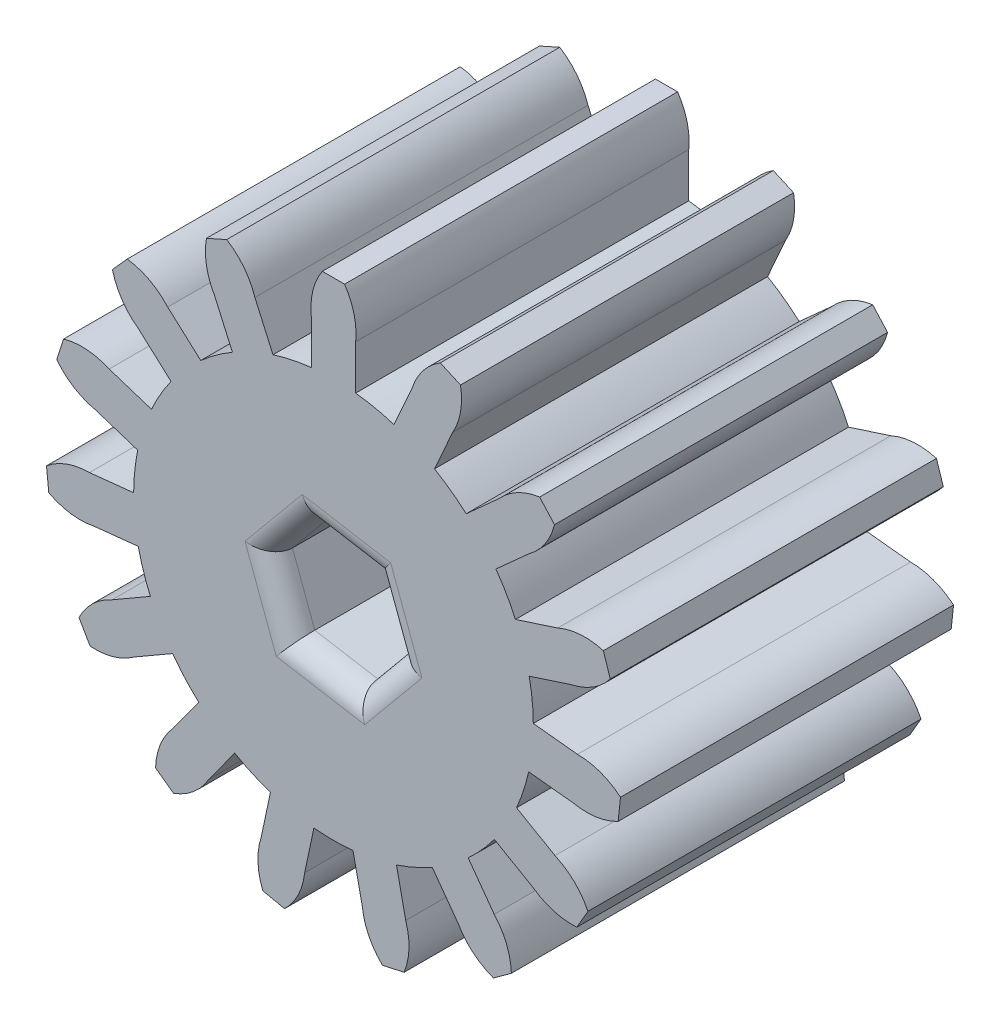
from build123d import *

# Parameters (mm, degrees)
SKETCH1_R                    = 9
SKETCH1_R_2                  = 1
BOSS_EXTRUDE1_DEPTH          = 36
SKETCH5_W                    = 5
SKETCH5_H                    = 4.08502449
SKETCH5_W_2                  = 8
BOSS_EXTRUDE2_DEPTH          = 22
SKETCH7_W                    = 5
SKETCH7_H                    = 4.653899232
CUT_REVOLVE2_ANGLE           = 90
CUT_REVOLVE2_OTHER_WAY_ANGLE = 90
CIRPATTERN1_COUNT            = 15
SKETCH13_W                   = 5
SKETCH13_H                   = 16.616445935
SKETCH17_R                   = 2
CUT_EXTRUDE1_DEPTH           = 10
CUT_EXTRUDE2_DEPTH           = 23
CUT_EXTRUDE2_DEPTH_BACK      = 8
SKETCH20_R                   = 20.157813079
CUT_EXTRUDE3_DEPTH           = 36
FILLET1_R                    = 1


with BuildPart() as part:
    # Sketch1 → Boss-Extrude1 (new body)
    with BuildSketch(Plane.XY):
        Circle(SKETCH1_R)
        Circle(SKETCH1_R_2, mode=Mode.SUBTRACT)
    extrude(amount=BOSS_EXTRUDE1_DEPTH)

    # Sketch5 → Cut-Revolve1 (revolve, cut)
    with BuildSketch(Plane(origin=(0, 0, 0), x_dir=(0, 0, -1), z_dir=(1, 0, 0)), mode=Mode.PRIVATE) as cut_revolve1_sk:
        with Locations((-2.5, 6.957487755)):
            Rectangle(SKETCH5_W, SKETCH5_H)
        with Locations((-32, 6.957487755)):
            Rectangle(SKETCH5_W_2, SKETCH5_H)
    revolve(cut_revolve1_sk.sketch.rotate(Axis((0, 0, 0), (0, 0, 1)), 90), axis=Axis((0, 0, 0), (0, 0, 1)), mode=Mode.SUBTRACT)

    # Sketch6 → Boss-Extrude2 (add)
    with BuildSketch(Plane.XY):
        with BuildLine():
            Line((-1, 8.94427191), (-1, 10.94427191))
            ThreePointArc((-1, 10.94427191), (-0.927189817, 11.988569364), (-0.5, 12.94427191))
            Line((-0.5, 12.94427191), (0.5, 12.94427191))
            ThreePointArc((0.5, 12.94427191), (0.927189817, 11.988569364), (1, 10.94427191))
            Line((1, 10.94427191), (1, 8.94427191))
            Line((1, 8.94427191), (-1, 8.94427191))
        make_face()
    boss_extrude2 = extrude(amount=BOSS_EXTRUDE2_DEPTH)

    # Sketch7 → Cut-Revolve2 (revolve, cut)
    with BuildSketch(Plane(origin=(0, 0, 0), x_dir=(0, 0, -1), z_dir=(1, 0, 0))):
        with Locations((-2.5, 11.271221526)):
            Rectangle(SKETCH7_W, SKETCH7_H)
    revolve(axis=Axis((0, 8.94427191, 5), (0, 0, -1)), revolution_arc=CUT_REVOLVE2_ANGLE, mode=Mode.SUBTRACT)

    # Sketch7 → Cut-Revolve2 other way (revolve, cut)
    with BuildSketch(Plane(origin=(0, 0, 0), x_dir=(0, 0, -1), z_dir=(1, 0, 0))):
        with Locations((-2.5, 11.271221526)):
            Rectangle(SKETCH7_W, SKETCH7_H)
    revolve(axis=Axis((0, 8.94427191, 5), (0, 0, 1)), revolution_arc=CUT_REVOLVE2_OTHER_WAY_ANGLE, mode=Mode.SUBTRACT)

    # CirPattern1: Boss-Extrude2 ×15 about axis
    cirpattern1_axis = Axis((0, 0, 0), (0, 0, 1))
    for i in range(1, CIRPATTERN1_COUNT):
        add(boss_extrude2.rotate(cirpattern1_axis, i * 360 / CIRPATTERN1_COUNT))

    # Sketch13 → Cut-Revolve6 (revolve, cut)
    with BuildSketch(Plane(origin=(0, 0, 0), x_dir=(0, 0, -1), z_dir=(1, 0, 0)), mode=Mode.PRIVATE) as cut_revolve6_sk:
        with Locations((-2.5, 8.308222968)):
            Rectangle(SKETCH13_W, SKETCH13_H)
    revolve(cut_revolve6_sk.sketch.rotate(Axis((0, 0, 25.578402878), (0, 0, -1)), 270), axis=Axis((0, 0, 25.578402878), (0, 0, -1)), mode=Mode.SUBTRACT)

    # Sketch17 → Cut-Extrude1 (cut)
    with BuildSketch(Plane(origin=(0, 0, 0), x_dir=(1, 0, 0), z_dir=(0, 1, 0))):
        with Locations(Location((-0.128741976, -25.11123185, 0), (0, 0, 270))):
            Circle(SKETCH17_R)
    extrude(amount=-CUT_EXTRUDE1_DEPTH, mode=Mode.SUBTRACT)

    # Sketch20 → Cut-Extrude2 (cut, two sides: drawn at the far end of the back side and taken through both)
    with BuildSketch(Plane.XY.offset(28).offset(-CUT_EXTRUDE2_DEPTH_BACK)):
        Circle(SKETCH20_R)
    extrude(amount=CUT_EXTRUDE2_DEPTH + CUT_EXTRUDE2_DEPTH_BACK, mode=Mode.SUBTRACT)

    # Sketch21 → Cut-Extrude3 (cut)
    with BuildSketch(Plane.XY.offset(20)):
        Polygon((1.840953559, 2.223560956), (-1.005183496, 2.706093028), (-2.846137055, 0.482532071), (-1.840953559, -2.223560956), (1.005183496, -2.706093028), (2.846137055, -0.482532071), align=None)
    extrude(amount=-CUT_EXTRUDE3_DEPTH, mode=Mode.SUBTRACT)

    # Fillet1
    fillet1_edges = [part.edges().sort_by_distance(p)[0] for p in [
        (2.343545307, 0.870514443, 5),
        (1.925660275, -1.594312549, 5),
        (-0.417885032, -2.464826992, 5),
        (-2.343545307, -0.870514443, 5),
        (-1.925660275, 1.594312549, 5),
        (0.417885032, 2.464826992, 5),
        (2.343545307, 0.870514443, 20),
        (0.417885032, 2.464826992, 20),
        (-1.925660275, 1.594312549, 20),
        (-2.343545307, -0.870514443, 20),
        (-0.417885032, -2.464826992, 20),
        (1.925660275, -1.594312549, 20),
    ]]
    fillet(fillet1_edges, radius=FILLET1_R)


solid = part.part
